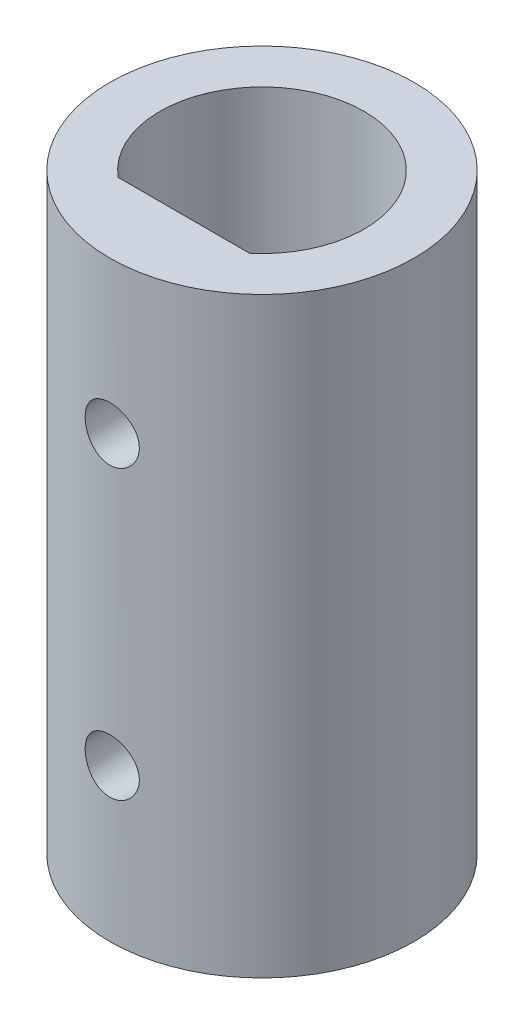
from build123d import *

# Parameters (mm, degrees)
SKETCH1_R           = 6.35
BOSS_EXTRUDE1_DEPTH = 24.7
SKETCH3_R           = 1.13
CUT_EXTRUDE1_DEPTH  = 28.253825364


with BuildPart() as part:
    # Sketch1 → Boss-Extrude1 (new body)
    with BuildSketch(Plane(origin=(0, 0, 0), x_dir=(1, 0, 0), z_dir=(0, 1, 0))):
        with Locations(Location((0, 0, 0), (0, 0, 270))):
            Circle(SKETCH1_R)
        with BuildLine():
            Line((-2.742383206, -3.260332823), (2.742383206, -3.260332823))
            ThreePointArc((2.742383206, -3.260332823), (0, 4.260332823), (-2.742383206, -3.260332823))
        make_face(mode=Mode.SUBTRACT)
    extrude(amount=BOSS_EXTRUDE1_DEPTH)

    # Sketch3 → Cut-Extrude1 (cut, through all)
    with BuildSketch(Plane(origin=(0, 0, 3.260332823), x_dir=(-1, 0, 0), z_dir=(0, 0, -1))):
        with Locations((0, 18.35)):
            Circle(SKETCH3_R)
        with Locations(Location((0, 6.35, 0), (0, 0, 270))):
            Circle(SKETCH3_R)
    extrude(amount=-CUT_EXTRUDE1_DEPTH, mode=Mode.SUBTRACT)


solid = part.part
